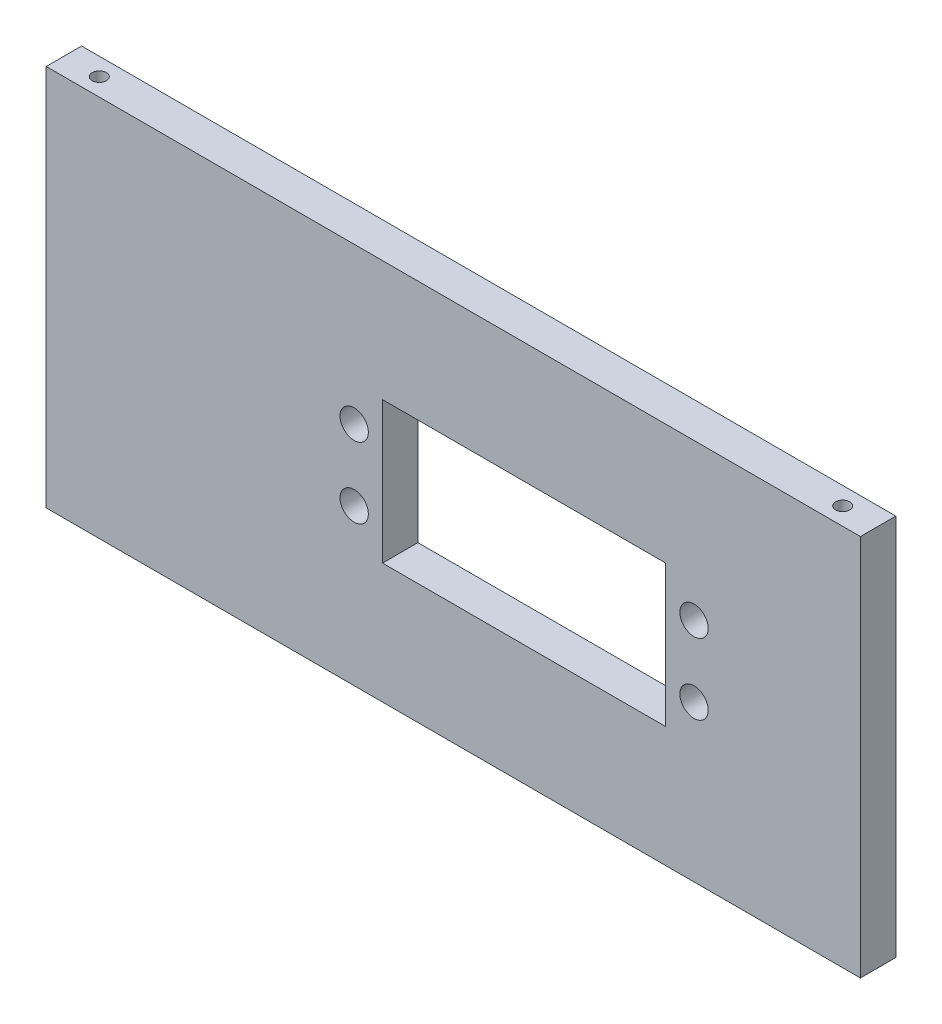
from build123d import *

# Parameters (mm, degrees)
SKETCH_1_W          = 115
SKETCH_1_H          = 54
SKETCH_1_R          = 2
SKETCH_1_W_2        = 40
SKETCH_1_H_2        = 20
EXTRUDE_3_DEPTH     = 5
SKETCH_2_R          = 1
CUT_EXTRUDE_1_DEPTH = 15
SKETCH_3_R          = 1.75
CUT_EXTRUDE_2_DEPTH = 15


with BuildPart() as part:
    # 草圖1 → 填料-伸長3 (new body)
    with BuildSketch(Plane.XY):
        with Locations((13.062480584, -3.484099434)):
            Rectangle(SKETCH_1_W, SKETCH_1_H)
        with Locations((-0.937519416, -8.484099434)):
            Circle(SKETCH_1_R, mode=Mode.SUBTRACT)
        with Locations((47.062480584, -8.484099434)):
            Circle(SKETCH_1_R, mode=Mode.SUBTRACT)
        with Locations((-0.937519416, 1.515900566)):
            Circle(SKETCH_1_R, mode=Mode.SUBTRACT)
        with Locations((47.062480584, 1.515900566)):
            Circle(SKETCH_1_R, mode=Mode.SUBTRACT)
        with Locations((23.062480584, -3.484099434)):
            Rectangle(SKETCH_1_W_2, SKETCH_1_H_2, mode=Mode.SUBTRACT)
    extrude(amount=EXTRUDE_3_DEPTH)

    # 草圖2 → 除料-伸長1 (cut)
    with BuildSketch(Plane(origin=(0, 23.515900566, 0), x_dir=(1, 0, 0), z_dir=(0, 1, 0))):
        with Locations(Location((-39.437519416, -2.5, 0), (0, 0, 270))):
            Circle(SKETCH_2_R)
        with Locations(Location((65.562480584, -2.5, 0), (0, 0, 270))):
            Circle(SKETCH_2_R)
    extrude(amount=-CUT_EXTRUDE_1_DEPTH, mode=Mode.SUBTRACT)

    # 草圖3 → 除料-伸長2 (cut)
    with BuildSketch(Plane.XZ.offset(30.484099434)):
        with Locations(Location((29.062480584, 2.5, 0), (0, 0, 270))):
            Circle(SKETCH_3_R)
        with Locations(Location((-2.937519416, 2.5, 0), (0, 0, 270))):
            Circle(SKETCH_3_R)
    extrude(amount=-CUT_EXTRUDE_2_DEPTH, mode=Mode.SUBTRACT)


solid = part.part
